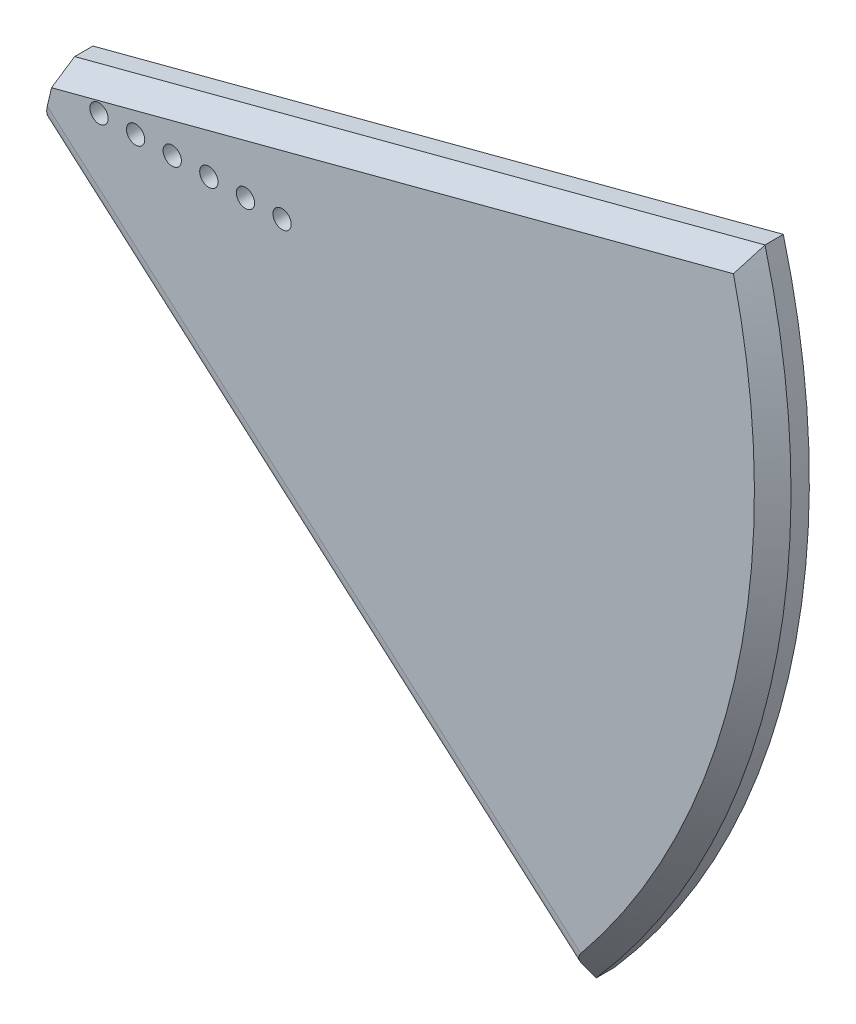
from build123d import *

# Parameters (mm, degrees)
SKETCH1_R           = 0.5
BOSS_EXTRUDE1_DEPTH = 2
CHAMFER1_SIZE       = 1
FILLET1_R           = 1


with BuildPart() as part:
    # Sketch1 → Boss-Extrude1 (new body)
    with BuildSketch(Plane.XY):
        with BuildLine():
            Line((3.867755102, 1.020034544), (41.578367347, 10.965371346))
            ThreePointArc((41.578367347, 10.965371346), (41.861667235, -9.828571429), (32.353812612, -28.323679307))
            Line((32.353812612, -28.323679307), (3.009656987, -2.634760866))
            Line((3.009656987, -2.634760866), (3.867755102, 1.020034544))
        make_face()
        with Locations((6.2, 0)):
            Circle(SKETCH1_R, mode=Mode.SUBTRACT)
        with Locations((8.2, 0)):
            Circle(SKETCH1_R, mode=Mode.SUBTRACT)
        with Locations((10.2, 0)):
            Circle(SKETCH1_R, mode=Mode.SUBTRACT)
        with Locations((12.2, 0)):
            Circle(SKETCH1_R, mode=Mode.SUBTRACT)
        with Locations((14.2, 0)):
            Circle(SKETCH1_R, mode=Mode.SUBTRACT)
        with Locations((16.2, 0)):
            Circle(SKETCH1_R, mode=Mode.SUBTRACT)
    extrude(amount=BOSS_EXTRUDE1_DEPTH)

    # Chamfer1
    chamfer1_edges = [part.edges().sort_by_distance(p)[0] for p in [
        (41.861667235, -9.828571429, 2),
        (22.723061224, 5.992702945, 2),
        (17.6817348, -15.479220086, 2),
    ]]
    chamfer(chamfer1_edges, length=CHAMFER1_SIZE)

    # Fillet1
    fillet1_edges = [part.edges().sort_by_distance(p)[0] for p in [
        (17.759814553, -14.218518771, 2),
    ]]
    fillet(fillet1_edges, radius=FILLET1_R)


solid = part.part
